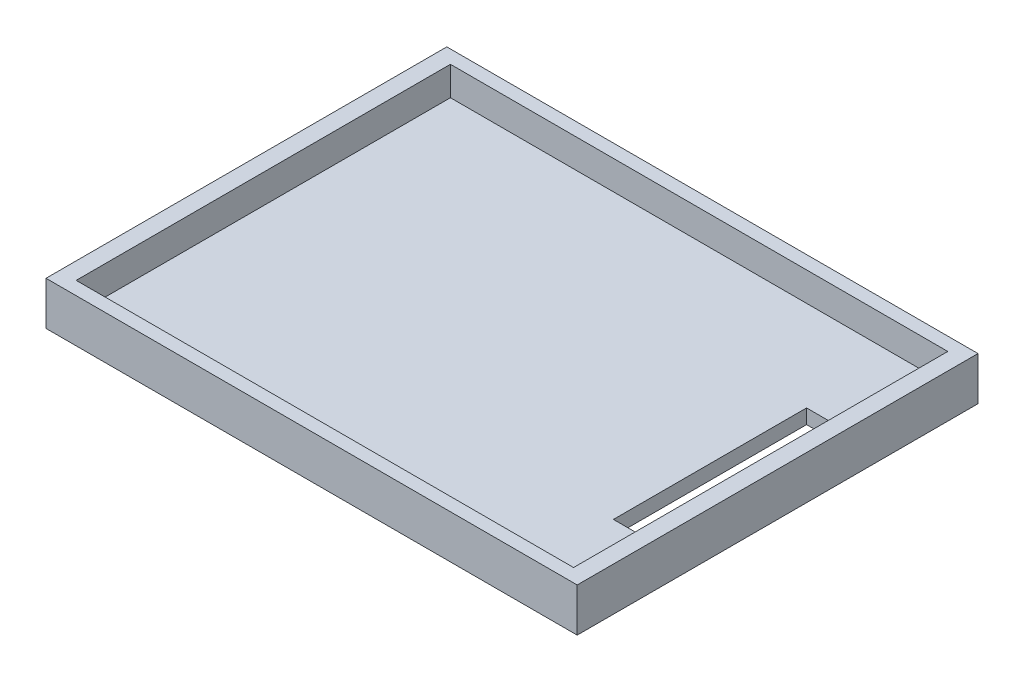
from build123d import *

# Parameters (mm, degrees)
SKETCH2_W           = 110
SKETCH2_H           = 83
SKETCH2_W_2         = 10
SKETCH2_H_2         = 40
BOSS_EXTRUDE1_DEPTH = 9
SKETCH4_W           = 103
SKETCH4_H           = 77.5
CUT_EXTRUDE1_DEPTH  = 6


with BuildPart() as part:
    # Sketch2 → Boss-Extrude1 (new body)
    with BuildSketch(Plane(origin=(0, 0, 0), x_dir=(1, 0, 0), z_dir=(0, 1, 0))):
        Rectangle(SKETCH2_W, SKETCH2_H)
        with Locations((46, 0)):
            Rectangle(SKETCH2_W_2, SKETCH2_H_2, mode=Mode.SUBTRACT)
    extrude(amount=BOSS_EXTRUDE1_DEPTH)

    # Sketch4 → Cut-Extrude1 (cut)
    with BuildSketch(Plane(origin=(0, 9, 0), x_dir=(1, 0, 0), z_dir=(0, 1, 0))):
        Rectangle(SKETCH4_W, SKETCH4_H)
    extrude(amount=-CUT_EXTRUDE1_DEPTH, mode=Mode.SUBTRACT)


solid = part.part
